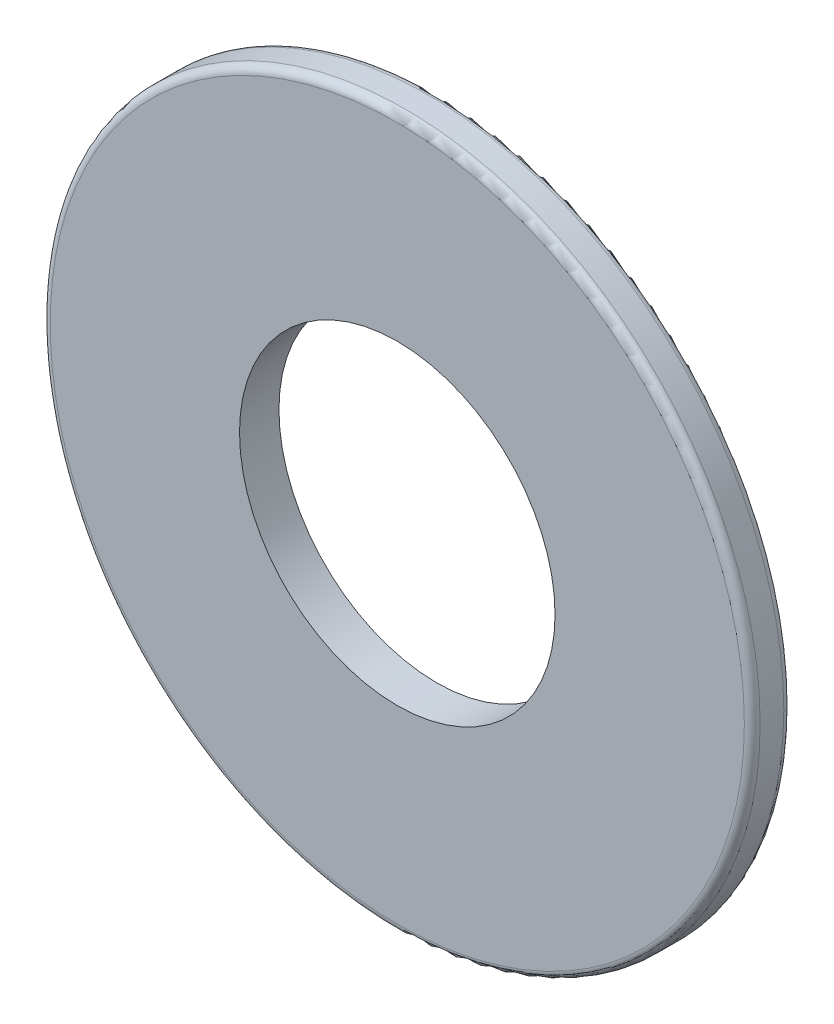
from build123d import *

# Parameters (mm, degrees)
ESQUISSE1_R        = 4.5
ESQUISSE1_R_2      = 2
BOSS_EXTRU_1_DEPTH = 0.5
CONG_1_R           = 0.1


with BuildPart() as part:
    # Esquisse1 → Boss.-Extru.1 (new body)
    with BuildSketch(Plane.XY):
        Circle(ESQUISSE1_R)
        Circle(ESQUISSE1_R_2, mode=Mode.SUBTRACT)
    extrude(amount=BOSS_EXTRU_1_DEPTH)

    # Congé1
    cong_1_edges = [part.edges().sort_by_distance(p)[0] for p in [
        (-4.5, 0, 0),
        (-4.5, 0, 0.5),
    ]]
    fillet(cong_1_edges, radius=CONG_1_R)


solid = part.part
